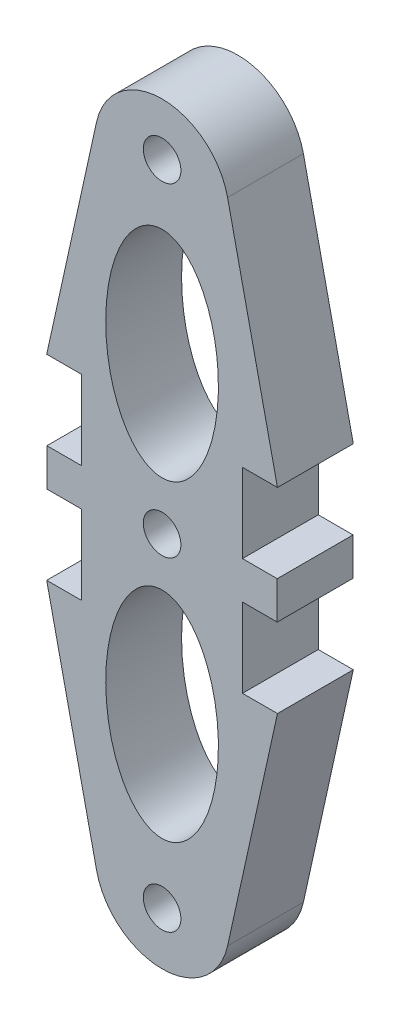
from build123d import *

# Parameters (mm, degrees)
SKETCH1_R           = 1.45
SKETCH1_RX          = 8.302080555
SKETCH1_RY          = 4.346497416
BOSS_EXTRUDE1_DEPTH = 5.85


with BuildPart() as part:
    # Sketch1 → Boss-Extrude1 (new body)
    with BuildSketch(Plane.XY):
        with BuildLine():
            Line((781.459168709, 464.852359197), (778.776092953, 464.852359197))
            Line((778.776092953, 464.852359197), (778.776092953, 461.952359197))
            Line((778.776092953, 461.952359197), (781.459168709, 461.952359197))
            Line((781.459168709, 461.952359197), (781.459168709, 455.852359197))
            Line((781.459168709, 455.852359197), (778.759168709, 455.852359197))
            Line((778.759168709, 455.852359197), (782.606547069, 438.402359197))
            ThreePointArc((782.606547069, 438.402359197), (787.659168709, 434.342389784), (792.711790348, 438.402359197))
            Line((792.711790348, 438.402359197), (796.559168709, 455.852359197))
            Line((796.559168709, 455.852359197), (793.859168709, 455.852359197))
            Line((793.859168709, 455.852359197), (793.859168709, 461.952359197))
            Line((793.859168709, 461.952359197), (796.542244464, 461.952359197))
            Line((796.542244464, 461.952359197), (796.542244464, 464.852359197))
            Line((796.542244464, 464.852359197), (793.859168709, 464.852359197))
            Line((793.859168709, 464.852359197), (793.859168709, 470.952359197))
            Line((793.859168709, 470.952359197), (796.559168709, 470.952359197))
            Line((796.559168709, 470.952359197), (792.711790348, 488.402359197))
            ThreePointArc((792.711790348, 488.402359197), (787.659168709, 492.46232861), (782.606547069, 488.402359197))
            Line((782.606547069, 488.402359197), (778.759168709, 470.952359197))
            Line((778.759168709, 470.952359197), (781.459168709, 470.952359197))
            Line((781.459168709, 470.952359197), (781.459168709, 464.852359197))
        make_face()
        with Locations((787.659168709, 488.402359197)):
            Circle(SKETCH1_R, mode=Mode.SUBTRACT)
        with Locations((787.659168709, 438.402359197)):
            Circle(SKETCH1_R, mode=Mode.SUBTRACT)
        with Locations((787.659168709, 463.402359197)):
            Circle(SKETCH1_R, mode=Mode.SUBTRACT)
        with Locations(Location((787.659168709, 475.448118238), (0, 0, 90))):
            Ellipse(SKETCH1_RX, SKETCH1_RY, mode=Mode.SUBTRACT)
        with Locations(Location((787.659168709, 451.356600156), (0, 0, -90))):
            Ellipse(SKETCH1_RX, SKETCH1_RY, mode=Mode.SUBTRACT)
    extrude(amount=BOSS_EXTRUDE1_DEPTH)


solid = part.part
